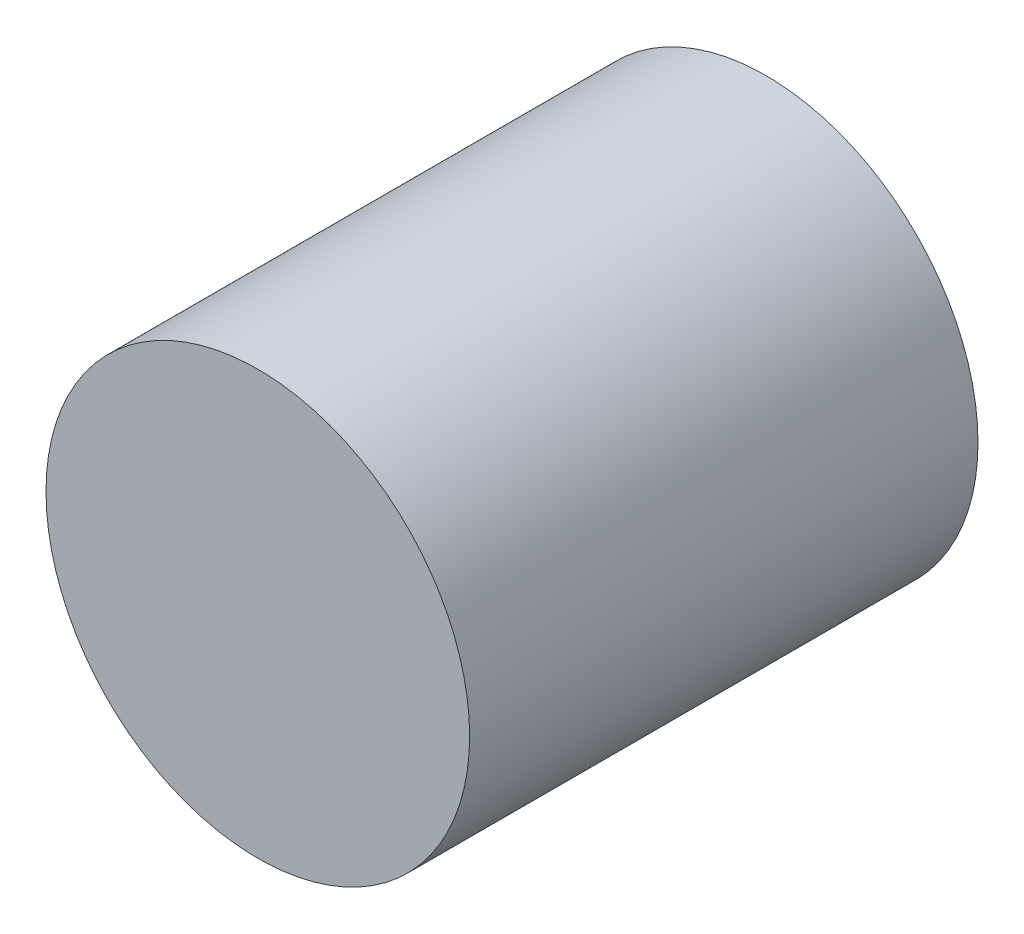
from build123d import *

# Parameters (mm, degrees)
SKETCH1_R           = 25
BOSS_EXTRUDE1_DEPTH = 60


with BuildPart() as part:
    # Sketch1 → Boss-Extrude1 (new body)
    with BuildSketch(Plane.XY):
        Circle(SKETCH1_R)
    extrude(amount=BOSS_EXTRUDE1_DEPTH)


solid = part.part
